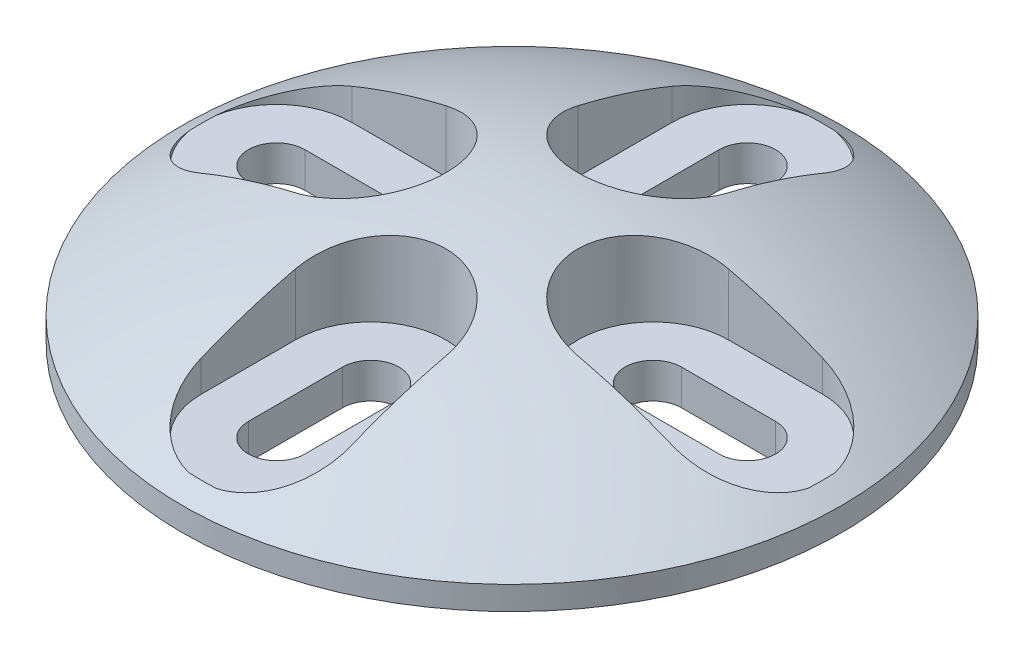
from build123d import *

# Parameters (mm, degrees)
CUT_EXTRUDE1_DEPTH = 21.420577857
CUT_EXTRUDE2_DEPTH = 3.5


with BuildPart() as part:
    # Sketch1 → Revolve1 (revolve)
    with BuildSketch(Plane.XY, mode=Mode.PRIVATE) as revolve1_sk:
        with BuildLine():
            Line((0, 0), (-14, 0))
            Line((-14, 0), (-14, 1))
            ThreePointArc((-14, 1), (-7.280109889, 3.980384612), (0, 5))
            Line((0, 5), (0, 0))
        make_face()
    revolve(revolve1_sk.sketch.rotate(Axis((0, 0, 0), (0, 1, 0)), 180), axis=Axis((0, 0, 0), (0, 1, 0)))

    # Sketch2 → Cut-Extrude1 (cut, through all)
    with BuildSketch(Plane(origin=(0, 5, 0), x_dir=(1, 0, 0), z_dir=(0, 1, 0))):
        with BuildLine():
            Line((1.2, 10), (1.2, 6))
            ThreePointArc((1.2, 6), (0, 4.8), (-1.2, 6))
            Line((-1.2, 6), (-1.2, 10))
            ThreePointArc((-1.2, 10), (0, 11.2), (1.2, 10))
        make_face()
        with BuildLine():
            Line((10, -1.2), (6, -1.2))
            ThreePointArc((6, -1.2), (4.8, 0), (6, 1.2))
            Line((6, 1.2), (10, 1.2))
            ThreePointArc((10, 1.2), (11.2, 0), (10, -1.2))
        make_face()
        with BuildLine():
            Line((-1.2, -10), (-1.2, -6))
            ThreePointArc((-1.2, -6), (0, -4.8), (1.2, -6))
            Line((1.2, -6), (1.2, -10))
            ThreePointArc((1.2, -10), (0, -11.2), (-1.2, -10))
        make_face()
        with BuildLine():
            Line((-10, 1.2), (-6, 1.2))
            ThreePointArc((-6, 1.2), (-4.8, 0), (-6, -1.2))
            Line((-6, -1.2), (-10, -1.2))
            ThreePointArc((-10, -1.2), (-11.2, 0), (-10, 1.2))
        make_face()
    extrude(amount=-CUT_EXTRUDE1_DEPTH, mode=Mode.SUBTRACT)

    # Sketch3 → Cut-Extrude2 (cut)
    with BuildSketch(Plane(origin=(0, 5, 0), x_dir=(1, 0, 0), z_dir=(0, 1, 0))):
        with BuildLine():
            Line((10.001792972, 3.197433741), (6.001792972, 3.197433741))
            ThreePointArc((6.001792972, 3.197433741), (2.801792972, -0.002566259), (6.001792972, -3.202566259))
            Line((6.001792972, -3.202566259), (10.001792972, -3.202566259))
            ThreePointArc((10.001792972, -3.202566259), (13.201792972, -0.002566259), (10.001792972, 3.197433741))
        make_face()
        with BuildLine():
            Line((3.2, 6), (3.2, 10))
            ThreePointArc((3.2, 10), (0, 13.2), (-3.2, 10))
            Line((-3.2, 10), (-3.2, 6))
            ThreePointArc((-3.2, 6), (0, 2.8), (3.2, 6))
        make_face()
        with BuildLine():
            Line((3.199226713, -10.004359231), (3.199226713, -6.004359231))
            ThreePointArc((3.199226713, -6.004359231), (-0.000773287, -2.804359231), (-3.200773287, -6.004359231))
            Line((-3.200773287, -6.004359231), (-3.200773287, -10.004359231))
            ThreePointArc((-3.200773287, -10.004359231), (-0.000773287, -13.204359231), (3.199226713, -10.004359231))
        make_face()
        with BuildLine():
            Line((-10.002566259, -3.201792972), (-6.002566259, -3.201792972))
            ThreePointArc((-6.002566259, -3.201792972), (-2.802566259, -0.001792972), (-6.002566259, 3.198207028))
            Line((-6.002566259, 3.198207028), (-10.002566259, 3.198207028))
            ThreePointArc((-10.002566259, 3.198207028), (-13.202566259, -0.001792972), (-10.002566259, -3.201792972))
        make_face()
    extrude(amount=-CUT_EXTRUDE2_DEPTH, mode=Mode.SUBTRACT)


solid = part.part
